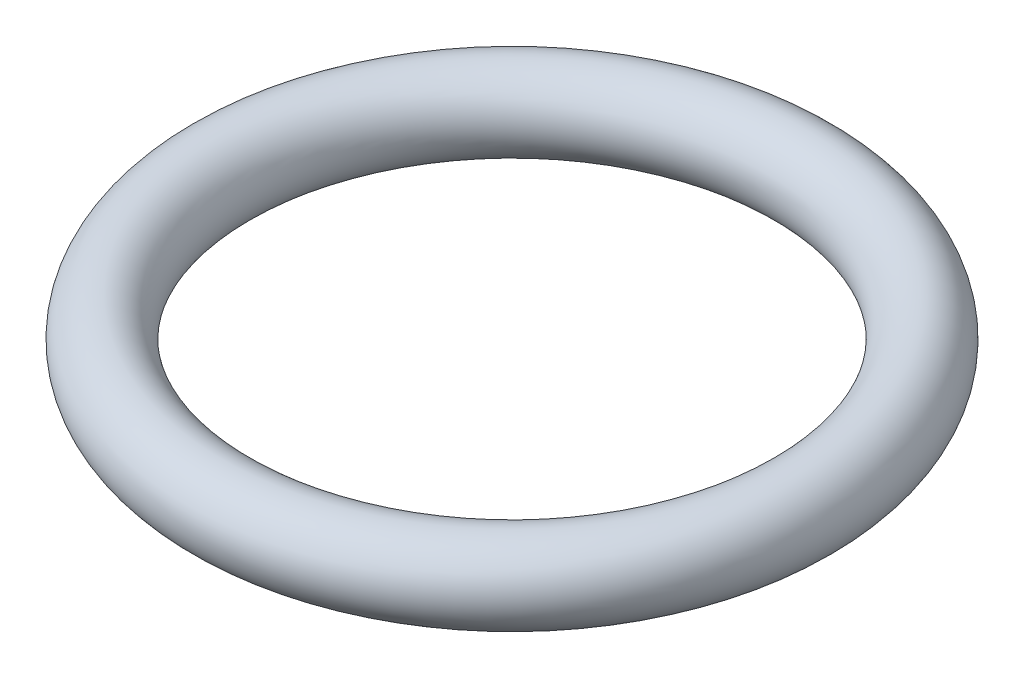
from build123d import *

# Parameters (mm, degrees)
MAINBODYS_R = 0.75


with BuildPart() as part:
    # MainBodyS → MAIN BODY (revolve)
    with BuildSketch(Plane.XY, mode=Mode.PRIVATE) as main_body_sk:
        with Locations((5.5, 0)):
            Circle(MAINBODYS_R)
    revolve(main_body_sk.sketch.rotate(Axis((0, 0, 0), (0, -1, 0)), 180), axis=Axis((0, 0, 0), (0, -1, 0)))


solid = part.part
